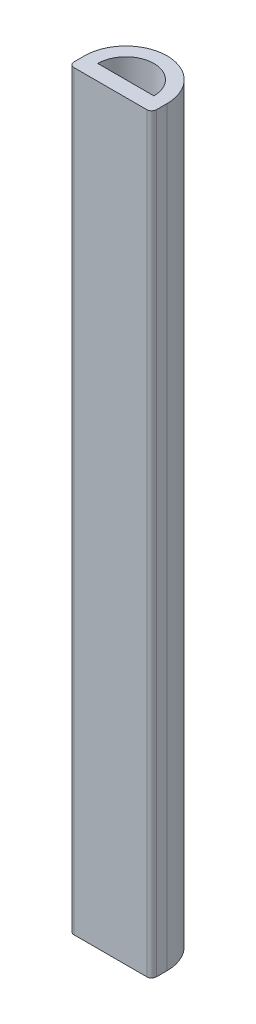
from build123d import *

# Parameters (mm, degrees)
SEMICIRCULAR_TUBE_DEPTH = 170
FILLET_EDGES_R          = 1.1


with BuildPart() as part:
    # Sketch1 → semicircular tube (new body)
    with BuildSketch(Plane(origin=(0, 0, 0), x_dir=(1, 0, 0), z_dir=(0, 1, 0))):
        with BuildLine():
            Line((-9.35, 0), (-9.35, -3.5))
            Line((-9.35, -3.5), (9.35, -3.5))
            Line((9.35, -3.5), (9.35, 0))
            ThreePointArc((9.35, 0), (0, 9.35), (-9.35, 0))
        make_face()
        with BuildLine():
            Line((-6.35, 0), (6.35, 0))
            ThreePointArc((6.35, 0), (0, 6.35), (-6.35, 0))
        make_face(mode=Mode.SUBTRACT)
    extrude(amount=SEMICIRCULAR_TUBE_DEPTH)

    # fillet edges
    fillet_edges_edges = [part.edges().sort_by_distance(p)[0] for p in [
        (9.35, 85, 3.5),
        (-9.35, 85, 3.5),
    ]]
    fillet(fillet_edges_edges, radius=FILLET_EDGES_R)


solid = part.part
